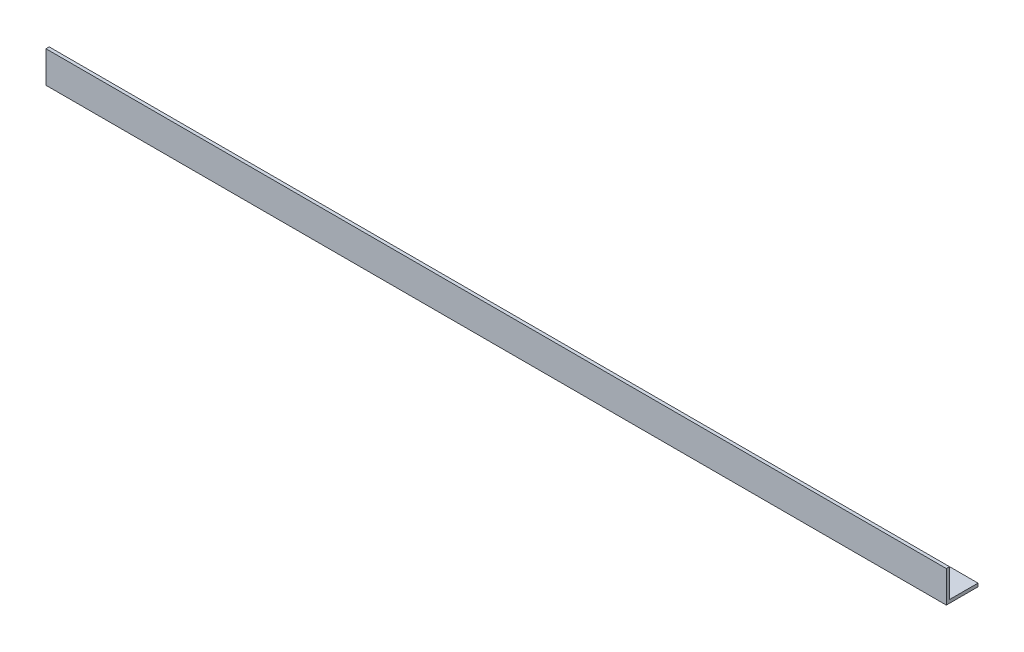
from build123d import *

# Parameters (mm, degrees)
SALIENTE_EXTRUIR1_DEPTH = 361


with BuildPart() as part:
    # Croquis2 → Saliente-Extruir1 (new body)
    with BuildSketch(Plane(origin=(0, 0, 0), x_dir=(0, 0, -1), z_dir=(1, 0, 0))):
        Polygon((0, 0), (0, -12.7), (12.7, -12.7), (12.7, -11.4), (1.3, -11.4), (1.3, 0), align=None)
    extrude(amount=SALIENTE_EXTRUIR1_DEPTH)


solid = part.part
